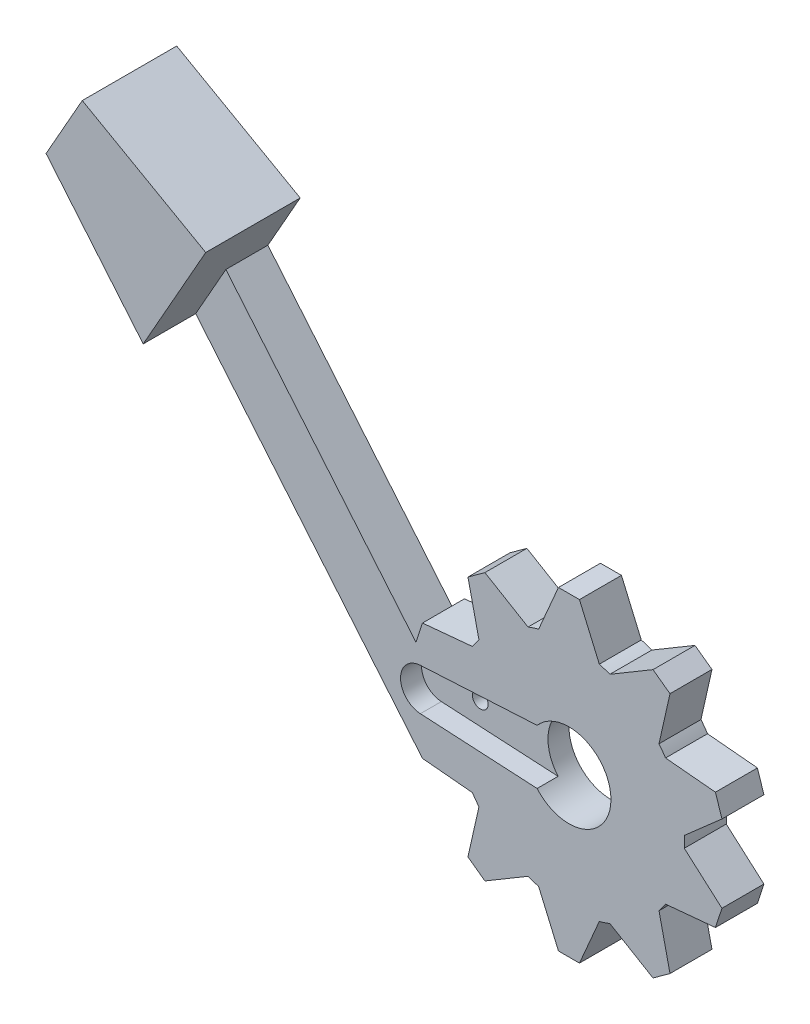
from build123d import *

# Parameters (mm, degrees)
SKETCH1_R           = 3.5
BOSS_EXTRUDE1_DEPTH = 4
BOSS_EXTRUDE2_DEPTH = 4
CUT_EXTRUDE1_DEPTH  = 2
SKETCH5_R           = 0.75
CUT_EXTRUDE2_DEPTH  = 59.571601855
SKETCH6_R           = 4
CUT_EXTRUDE3_DEPTH  = 10
BOSS_EXTRUDE3_DEPTH = 5


with BuildPart() as part:
    # Sketch1 → Boss-Extrude1 (new body)
    with BuildSketch(Plane.XY):
        with BuildLine():
            Line((-1, 15), (1, 15))
            Line((1, 15), (2.890622598, 10.613401952))
            ThreePointArc((2.890622598, 10.613401952), (3.399186938, 10.461621679), (3.899838338, 10.28548788))
            Line((3.899838338, 10.28548788), (8.00776179, 12.723040168))
            Line((8.00776179, 12.723040168), (9.625795779, 11.547469663))
            Line((9.625795779, 11.547469663), (8.57696395, 6.887357214))
            ThreePointArc((8.57696395, 6.887357214), (8.899186938, 6.465637775), (9.200693579, 6.02886703))
            Line((9.200693579, 6.02886703), (13.95683075, 5.586311432))
            Line((13.95683075, 5.586311432), (14.574864739, 3.684198399))
            Line((14.574864739, 3.684198399), (10.987196594, 0.530576113))
            ThreePointArc((10.987196594, 0.530576113), (11, 0), (10.987196594, -0.530576113))
            Line((10.987196594, -0.530576113), (14.574864739, -3.684198399))
            Line((14.574864739, -3.684198399), (13.95683075, -5.586311432))
            Line((13.95683075, -5.586311432), (9.200693579, -6.02886703))
            ThreePointArc((9.200693579, -6.02886703), (8.899186938, -6.465637775), (8.57696395, -6.887357214))
            Line((8.57696395, -6.887357214), (9.625795779, -11.547469663))
            Line((9.625795779, -11.547469663), (8.00776179, -12.723040168))
            Line((8.00776179, -12.723040168), (3.899838338, -10.28548788))
            ThreePointArc((3.899838338, -10.28548788), (3.399186938, -10.461621679), (2.890622598, -10.613401952))
            Line((2.890622598, -10.613401952), (1, -15))
            Line((1, -15), (-1, -15))
            Line((-1, -15), (-2.890622598, -10.613401952))
            ThreePointArc((-2.890622598, -10.613401952), (-3.399186938, -10.461621679), (-3.899838338, -10.28548788))
            Line((-3.899838338, -10.28548788), (-8.00776179, -12.723040168))
            Line((-8.00776179, -12.723040168), (-9.625795779, -11.547469663))
            Line((-9.625795779, -11.547469663), (-8.57696395, -6.887357214))
            ThreePointArc((-8.57696395, -6.887357214), (-8.899186938, -6.465637775), (-9.200693579, -6.02886703))
            Line((-9.200693579, -6.02886703), (-13.95683075, -5.586311432))
            Line((-13.95683075, -5.586311432), (-14.574864739, -3.684198399))
            Line((-14.574864739, -3.684198399), (-10.987196594, -0.530576113))
            ThreePointArc((-10.987196594, -0.530576113), (-11, 0), (-10.987196594, 0.530576113))
            Line((-10.987196594, 0.530576113), (-14.574864739, 3.684198399))
            Line((-14.574864739, 3.684198399), (-13.95683075, 5.586311432))
            Line((-13.95683075, 5.586311432), (-9.200693579, 6.02886703))
            ThreePointArc((-9.200693579, 6.02886703), (-8.899186938, 6.465637775), (-8.57696395, 6.887357214))
            Line((-8.57696395, 6.887357214), (-9.625795779, 11.547469663))
            Line((-9.625795779, 11.547469663), (-8.00776179, 12.723040168))
            Line((-8.00776179, 12.723040168), (-3.899838338, 10.28548788))
            ThreePointArc((-3.899838338, 10.28548788), (-3.399186938, 10.461621679), (-2.890622598, 10.613401952))
            Line((-2.890622598, 10.613401952), (-1, 15))
        make_face()
        Circle(SKETCH1_R, mode=Mode.SUBTRACT)
    extrude(amount=-BOSS_EXTRUDE1_DEPTH)

    # Sketch3 → Boss-Extrude2 (add)
    with BuildSketch(Plane.XY):
        Polygon((-41.373550062, 37.492275487), (-29.610808295, 30.834868856), (-32.690631554, 25.393235547), (-14.574864739, 3.684198399), (-10.987196594, 0.530576113), (-10.987196594, -0.530576113), (-14.574864739, -3.684198399), (-13.95683075, -5.586311432), (-44.821443781, 31.400311198), align=None)
    extrude(amount=-BOSS_EXTRUDE2_DEPTH)

    # Sketch4 → Cut-Extrude1 (cut)
    with BuildSketch(Plane.XY):
        with BuildLine():
            Line((-14.159121967, -1.99702088), (-2.291588247, -2.645491127))
            ThreePointArc((-2.291588247, -2.645491127), (-3.5, 0), (-2.291588247, 2.645491127))
            Line((-2.291588247, 2.645491127), (-14.159121967, 1.99702088))
            ThreePointArc((-14.159121967, 1.99702088), (-16.05, 0), (-14.159121967, -1.99702088))
        make_face()
    extrude(amount=-CUT_EXTRUDE1_DEPTH, mode=Mode.SUBTRACT)

    # Sketch5 → Cut-Extrude2 (cut, through all)
    with BuildSketch(Plane.XY):
        with Locations((-10.45, 0)):
            Circle(SKETCH5_R)
    extrude(amount=-CUT_EXTRUDE2_DEPTH, mode=Mode.SUBTRACT)

    # Sketch6 → Cut-Extrude3 (cut)
    with BuildSketch(Plane.XY):
        Circle(SKETCH6_R)
    extrude(amount=-CUT_EXTRUDE3_DEPTH, mode=Mode.SUBTRACT)

    # Sketch7 → Boss-Extrude3 (add)
    with BuildSketch(Plane.XY):
        Polygon((-29.610808295, 30.834868856), (-41.373550062, 37.492275487), (-44.821443781, 31.400311198), (-35.567281633, 20.310581908), align=None)
    extrude(amount=BOSS_EXTRUDE3_DEPTH)


solid = part.part
